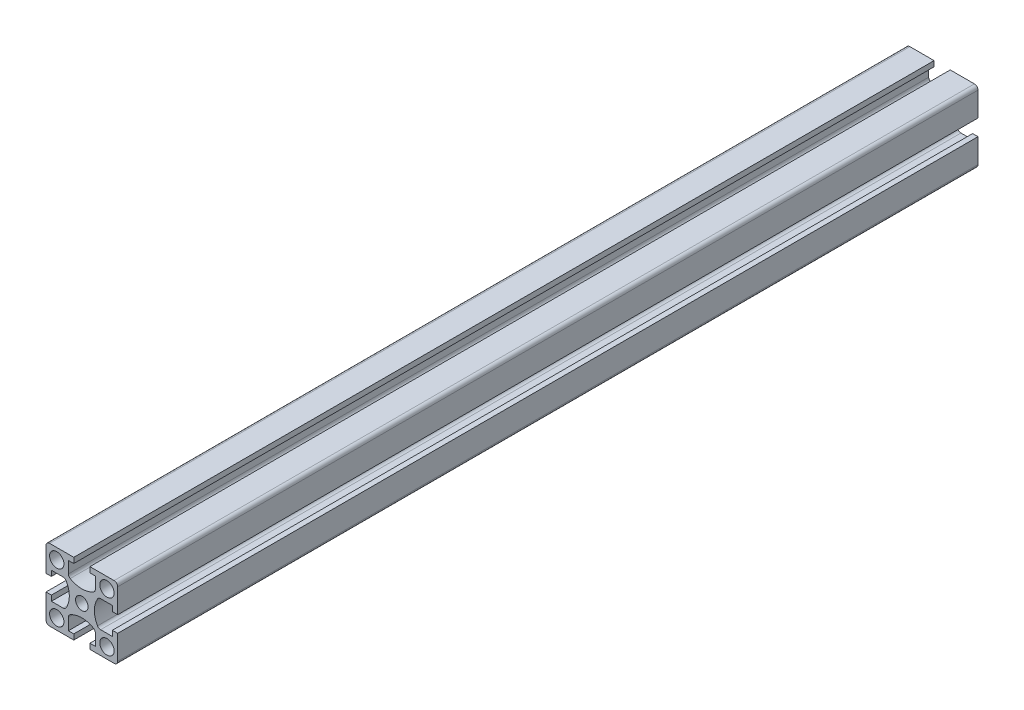
from build123d import *

# Parameters (mm, degrees)
SKETCH1_R           = 5
SKETCH1_R_2         = 4.375
BOSS_EXTRUDE1_DEPTH = 600


with BuildPart() as part:
    # Sketch1 → Boss-Extrude1 (new body)
    with BuildSketch(Plane.XY):
        with BuildLine():
            Line((-25, 22.5), (-25, 5.625))
            Line((-25, 5.625), (-21.25, 5.625))
            Line((-21.25, 5.625), (-21.25, 9.375))
            Line((-21.25, 9.375), (-13.092150698, 9.375))
            ThreePointArc((-13.092150698, 9.375), (-11.842150698, 9.040063509), (-10.927087189, 8.125))
            ThreePointArc((-10.927087189, 8.125), (-8.75, 0), (-10.927087189, -8.125))
            ThreePointArc((-10.927087189, -8.125), (-11.842150698, -9.040063509), (-13.092150698, -9.375))
            Line((-13.092150698, -9.375), (-21.25, -9.375))
            Line((-21.25, -9.375), (-21.25, -5.625))
            Line((-21.25, -5.625), (-25, -5.625))
            Line((-25, -5.625), (-25, -22.5))
            ThreePointArc((-25, -22.5), (-24.267766953, -24.267766953), (-22.5, -25))
            Line((-22.5, -25), (-5.625, -25))
            Line((-5.625, -25), (-5.625, -21.25))
            Line((-5.625, -21.25), (-9.375, -21.25))
            Line((-9.375, -21.25), (-9.375, -13.092150698))
            ThreePointArc((-9.375, -13.092150698), (-9.040063509, -11.842150698), (-8.125, -10.927087189))
            ThreePointArc((-8.125, -10.927087189), (0, -8.75), (8.125, -10.927087189))
            ThreePointArc((8.125, -10.927087189), (9.040063509, -11.842150698), (9.375, -13.092150698))
            Line((9.375, -13.092150698), (9.375, -21.25))
            Line((9.375, -21.25), (5.625, -21.25))
            Line((5.625, -21.25), (5.625, -25))
            Line((5.625, -25), (22.5, -25))
            ThreePointArc((22.5, -25), (24.267766953, -24.267766953), (25, -22.5))
            Line((25, -22.5), (25, -5.625))
            Line((25, -5.625), (21.25, -5.625))
            Line((21.25, -5.625), (21.25, -9.375))
            Line((21.25, -9.375), (13.092150698, -9.375))
            ThreePointArc((13.092150698, -9.375), (11.842150698, -9.040063509), (10.927087189, -8.125))
            ThreePointArc((10.927087189, -8.125), (8.75, 0), (10.927087189, 8.125))
            ThreePointArc((10.927087189, 8.125), (11.842150698, 9.040063509), (13.092150698, 9.375))
            Line((13.092150698, 9.375), (21.25, 9.375))
            Line((21.25, 9.375), (21.25, 5.625))
            Line((21.25, 5.625), (25, 5.625))
            Line((25, 5.625), (25, 22.5))
            ThreePointArc((25, 22.5), (24.267766953, 24.267766953), (22.5, 25))
            Line((22.5, 25), (5.625, 25))
            Line((5.625, 25), (5.625, 21.25))
            Line((5.625, 21.25), (9.375, 21.25))
            Line((9.375, 21.25), (9.375, 13.092150698))
            ThreePointArc((9.375, 13.092150698), (9.040063509, 11.842150698), (8.125, 10.927087189))
            ThreePointArc((8.125, 10.927087189), (0, 8.75), (-8.125, 10.927087189))
            ThreePointArc((-8.125, 10.927087189), (-9.040063509, 11.842150698), (-9.375, 13.092150698))
            Line((-9.375, 13.092150698), (-9.375, 21.25))
            Line((-9.375, 21.25), (-5.625, 21.25))
            Line((-5.625, 21.25), (-5.625, 25))
            Line((-5.625, 25), (-22.5, 25))
            ThreePointArc((-22.5, 25), (-24.267766953, 24.267766953), (-25, 22.5))
        make_face()
        with Locations((-17.5, -17.5)):
            Circle(SKETCH1_R, mode=Mode.SUBTRACT)
        with Locations((17.5, -17.5)):
            Circle(SKETCH1_R, mode=Mode.SUBTRACT)
        with Locations((17.5, 17.5)):
            Circle(SKETCH1_R, mode=Mode.SUBTRACT)
        Circle(SKETCH1_R_2, mode=Mode.SUBTRACT)
        with Locations((-17.5, 17.5)):
            Circle(SKETCH1_R, mode=Mode.SUBTRACT)
    extrude(amount=BOSS_EXTRUDE1_DEPTH)


solid = part.part
